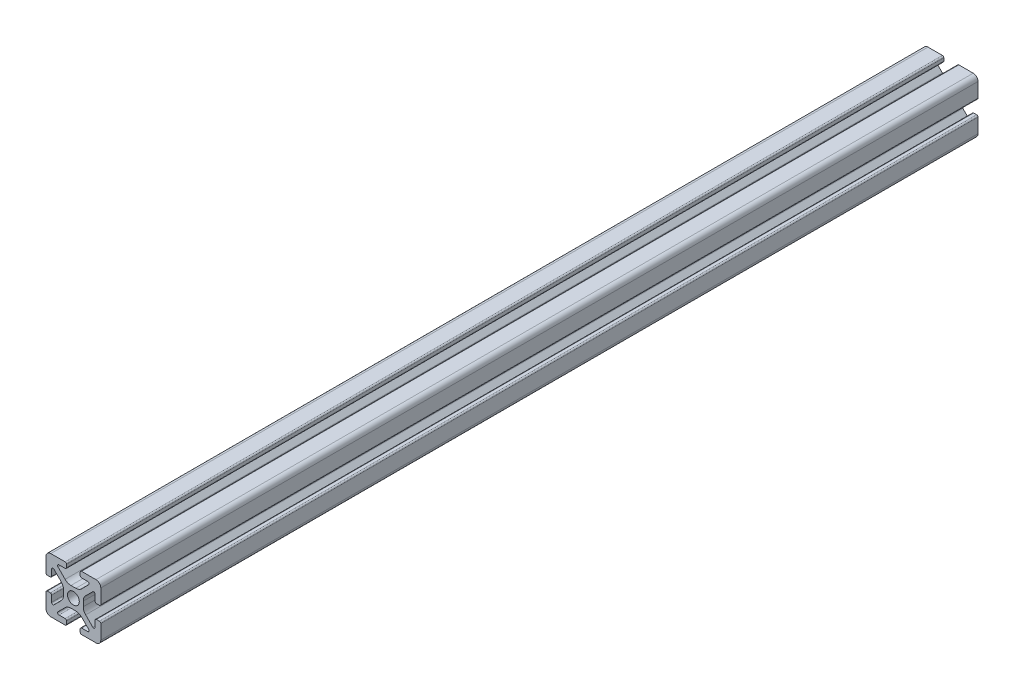
from build123d import *

# Parameters (mm, degrees)
BOSS_EXTRUDE1_DEPTH = 161.3333
SKETCH5_W           = 27.787302718
SKETCH5_H           = 26.03929452
CUT_EXTRUDE1_DEPTH  = 2.4


with BuildPart() as part:
    # Sketch4 → Boss-Extrude1 (new, symmetric)
    with BuildSketch(Plane.XY):
        with BuildLine():
            Line((3, -10), (8.25, -10))
            ThreePointArc((8.25, -10), (9.487436867, -9.487436867), (10, -8.25))
            Line((10, -8.25), (10, -3))
            ThreePointArc((10, -3), (9.853553391, -2.646446609), (9.5, -2.5))
            Line((9.5, -2.5), (8.424621202, -2.5))
            ThreePointArc((8.424621202, -2.5), (8.071067812, -2.646446609), (7.924621202, -3))
            Line((7.924621202, -3), (7.924621202, -5.25))
            ThreePointArc((7.924621202, -5.25), (7.615962919, -5.711939766), (7.071067812, -5.603553391))
            Line((7.071067812, -5.603553391), (4.478679656, -3.011165235))
            ThreePointArc((4.478679656, -3.011165235), (3.828361402, -2.037895189), (3.6, -0.889844892))
            Line((3.6, -0.889844892), (3.6, 0))
            Line((3.6, 0), (2.15, 0))
            ThreePointArc((2.15, 0), (1.52027958, -1.52027958), (0, -2.15))
            Line((0, -2.15), (0, -3.6))
            Line((0, -3.6), (0.889844892, -3.6))
            ThreePointArc((0.889844892, -3.6), (2.037895189, -3.828361402), (3.011165235, -4.478679656))
            Line((3.011165235, -4.478679656), (5.603553391, -7.071067812))
            ThreePointArc((5.603553391, -7.071067812), (5.711939766, -7.615962919), (5.25, -7.924621202))
            Line((5.25, -7.924621202), (3, -7.924621202))
            ThreePointArc((3, -7.924621202), (2.646446609, -8.071067812), (2.5, -8.424621202))
            Line((2.5, -8.424621202), (2.5, -9.5))
            ThreePointArc((2.5, -9.5), (2.646446609, -9.853553391), (3, -10))
        make_face()
    extrude(amount=BOSS_EXTRUDE1_DEPTH, both=True)

    # Mirror1: part across plane


with BuildPart() as part_1:
    add(part.part)
    add(part.part.mirror(Plane(origin=(0, 0, 0), x_dir=(0, 0, 1), z_dir=(1, 0, 0))))

    # Mirror2: part across plane


with BuildPart() as part_2:
    add(part_1.part)
    add(part_1.part.mirror(Plane.ZX))

    # Sketch5 → Cut-Extrude1 (cut)
    with BuildSketch(Plane.XY.offset(161.3333)):
        with Locations((-0.060276145, -0.663037592)):
            Rectangle(SKETCH5_W, SKETCH5_H)
    extrude(amount=-CUT_EXTRUDE1_DEPTH, mode=Mode.SUBTRACT)


solid = part_2.part
